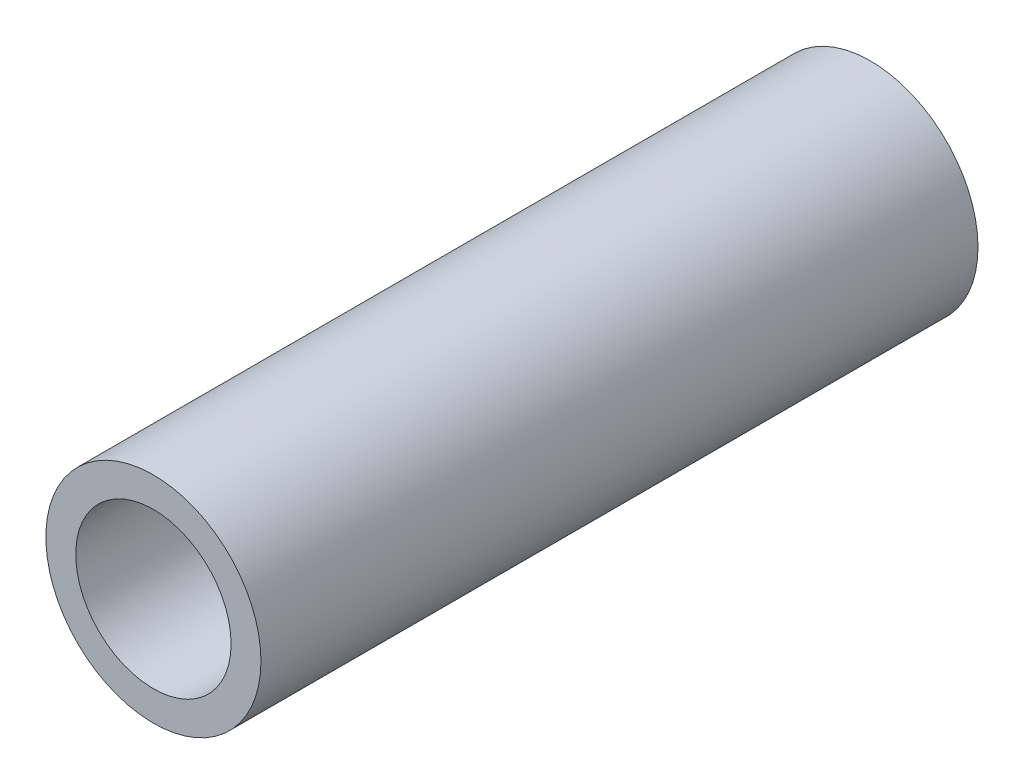
from build123d import *

# Parameters (mm, degrees)
BOSS_EXTRUDE1_DEPTH      = 30
BOSS_EXTRUDE1_DEPTH_BACK = 30
SKETCH1_R                = 9
SKETCH1_R_2              = 6.5


with BuildPart() as part:
    # Sketch1 → Boss-Extrude1 (new, two sides: drawn at the far end of the back side and taken through both)
    with BuildSketch(Plane.XY.offset(-BOSS_EXTRUDE1_DEPTH_BACK)):
        Circle(SKETCH1_R)
        Circle(SKETCH1_R_2, mode=Mode.SUBTRACT)
    extrude(amount=BOSS_EXTRUDE1_DEPTH + BOSS_EXTRUDE1_DEPTH_BACK)


solid = part.part
